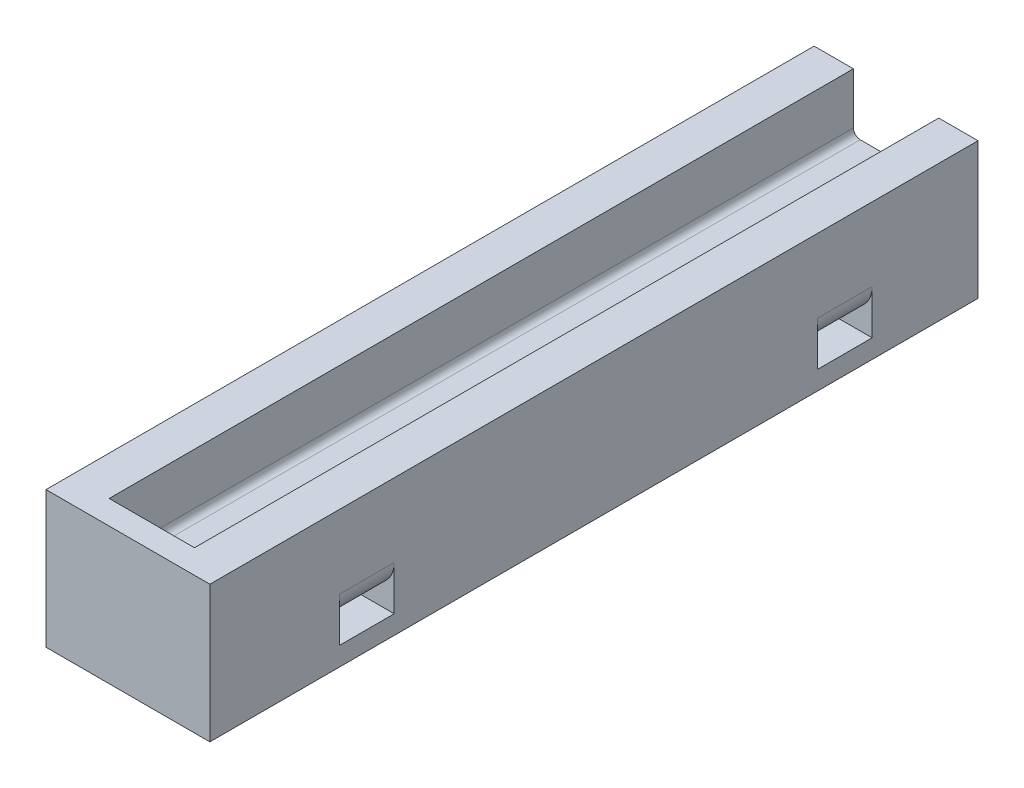
from build123d import *

# Parameters (mm, degrees)
SKETCH1_W                 = 12.5
SKETCH1_H                 = 11.5
BOSS_EXTRUDE1_DEPTH       = 109
SKETCH2_W                 = 24
SKETCH2_H                 = 20
BOSS_EXTRUDE2_DEPTH       = 3.5
F_2_5MM_DOWEL_HOLE1_D     = 3.2
F_2_5MM_DOWEL_HOLE1_DEPTH = 6.5
F_2_5MM_DOWEL_HOLE1_TIP   = 0.96137699
SKETCH5_W                 = 8
SKETCH5_H                 = 2.5
CUT_EXTRUDE1_DEPTH        = 117.757226757
FILLET1_R                 = 4
CHAMFER1_SIZE             = 0.5
FILLET2_R                 = 1


with BuildPart() as part:
    # Sketch1 → Boss-Extrude1 (new body)
    with BuildSketch(Plane.XY):
        Polygon((-37.25, 0), (-37.25, 11.5), (-37.25, 20), (-43, 20), (-43, 0), align=None)
        with Locations((-31, 5.75)):
            Rectangle(SKETCH1_W, SKETCH1_H)
        Polygon((-24.75, 20), (-24.75, 11.5), (-24.75, 0), (-19, 0), (-19, 20), align=None)
    extrude(amount=BOSS_EXTRUDE1_DEPTH)

    # Sketch2 → Boss-Extrude2 (add)
    with BuildSketch(Plane.XY.offset(109)):
        with Locations((-31, 10)):
            Rectangle(SKETCH2_W, SKETCH2_H)
    extrude(amount=BOSS_EXTRUDE2_DEPTH)

    # Ø2.5mm Dowel Hole1
    with Locations(Plane(origin=(0, 0, 0), x_dir=(-1, 0, 0), z_dir=(0, 0, -1))):
        with Locations((36, 5.6), (26, 5.6)):
            Hole(F_2_5MM_DOWEL_HOLE1_D / 2, depth=F_2_5MM_DOWEL_HOLE1_DEPTH)
            with Locations((0, 0, -(F_2_5MM_DOWEL_HOLE1_DEPTH + F_2_5MM_DOWEL_HOLE1_TIP / 2))):  # 118° drill point
                Cone(0, F_2_5MM_DOWEL_HOLE1_D / 2, F_2_5MM_DOWEL_HOLE1_TIP, mode=Mode.SUBTRACT)

    # Sketch5 → Cut-Extrude1 (cut, through all)
    with BuildSketch(Plane(origin=(-19, 0, 0), x_dir=(0, 0, -1), z_dir=(1, 0, 0))):
        with Locations((-89.5, 4)):
            Rectangle(SKETCH5_W, SKETCH5_H)
        with Locations((-19.5, 4)):
            Rectangle(SKETCH5_W, SKETCH5_H)
    extrude(amount=-CUT_EXTRUDE1_DEPTH, mode=Mode.SUBTRACT)

    # Fillet1
    fillet1_edges = [part.edges().sort_by_distance(p)[0] for p in [
        (-43, 5.25, 89.5),
        (-19, 5.25, 89.5),
        (-43, 5.25, 19.5),
        (-19, 5.25, 19.5),
    ]]
    fillet(fillet1_edges, radius=FILLET1_R)

    # Chamfer1
    chamfer1_edges = [part.edges().sort_by_distance(p)[0] for p in [
        (-37.6, 5.6, 0),
        (-27.6, 5.6, 0),
    ]]
    chamfer(chamfer1_edges, length=CHAMFER1_SIZE)

    # Fillet2
    fillet2_edges = [part.edges().sort_by_distance(p)[0] for p in [
        (-37.25, 11.5, 54.5),
        (-24.75, 11.5, 54.5),
    ]]
    fillet(fillet2_edges, radius=FILLET2_R)


solid = part.part
